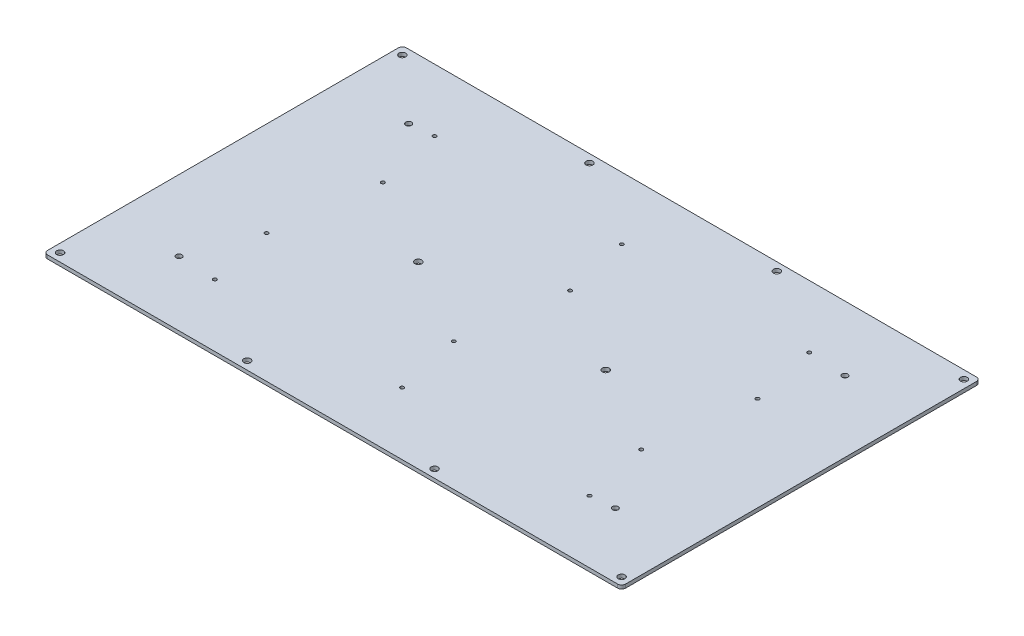
from build123d import *

# Parameters (mm, degrees)
SKETCH1_W                 = 368.3
SKETCH1_H                 = 228.6
BOSS_EXTRUDE1_DEPTH       = 2.286
F_6_CLEARANCE_HOLE1_D     = 3.6576
TAP_DRILL_FOR_4_40_TAP1_D = 2.2606
FILLET1_R                 = 2.54
F_8_CLEARANCE_HOLE1_D     = 4.3053


with BuildPart() as part:
    # Sketch1 → Boss-Extrude1 (new body)
    with BuildSketch(Plane(origin=(0, 0, 0), x_dir=(1, 0, 0), z_dir=(0, 1, 0))):
        Rectangle(SKETCH1_W, SKETCH1_H)
    extrude(amount=BOSS_EXTRUDE1_DEPTH)

    # #6 Clearance Hole1 (through all)
    with Locations(Plane(origin=(0, 0, 0), x_dir=(-1, 0, 0), z_dir=(0, -1, 0))):
        with Locations((-139.0015, 73.152), (139.0015, 73.152), (139.0015, -73.152), (-139.0015, -73.152)):
            Hole(F_6_CLEARANCE_HOLE1_D / 2)

    # Tap Drill for #4-40 Tap1 (through all)
    with Locations(Plane(origin=(0, 0, 0), x_dir=(-1, 0, 0), z_dir=(0, -1, 0))):
        with Locations((-114.847391596, 74.54728998), (-123.912608404, 32.51371002), (4.532608404, 74.54728998), (-4.532608404, 32.51371002), (123.912608404, 74.54728998), (114.847391596, 32.51371002), (123.912608404, -32.51371002), (114.847391596, -74.54728998), (4.532608404, -32.51371002), (-4.532608404, -74.54728998), (-114.847391596, -32.51371002), (-123.912608404, -74.54728998)):
            Hole(TAP_DRILL_FOR_4_40_TAP1_D / 2)

    # Fillet1
    fillet1_edges = [part.edges().sort_by_distance(p)[0] for p in [
        (184.15, 1.143, 114.3),
        (-184.15, 1.143, 114.3),
        (-184.15, 1.143, -114.3),
        (184.15, 1.143, -114.3),
    ]]
    fillet(fillet1_edges, radius=FILLET1_R)

    # #8 Clearance Hole1 (through all)
    with Locations(Plane(origin=(0, 0, 0), x_dir=(-1, 0, 0), z_dir=(0, -1, 0))):
        with Locations((59.69, 0), (-178.907772673, 109.057772673), (178.907772673, -109.057772673), (-178.907772673, -109.057772673), (178.907772673, 109.057772673), (-59.69, -109.057772673), (-59.69, 109.057772673), (59.69, -109.057772673), (59.69, 109.057772673), (-59.69, 0)):
            Hole(F_8_CLEARANCE_HOLE1_D / 2)


solid = part.part
